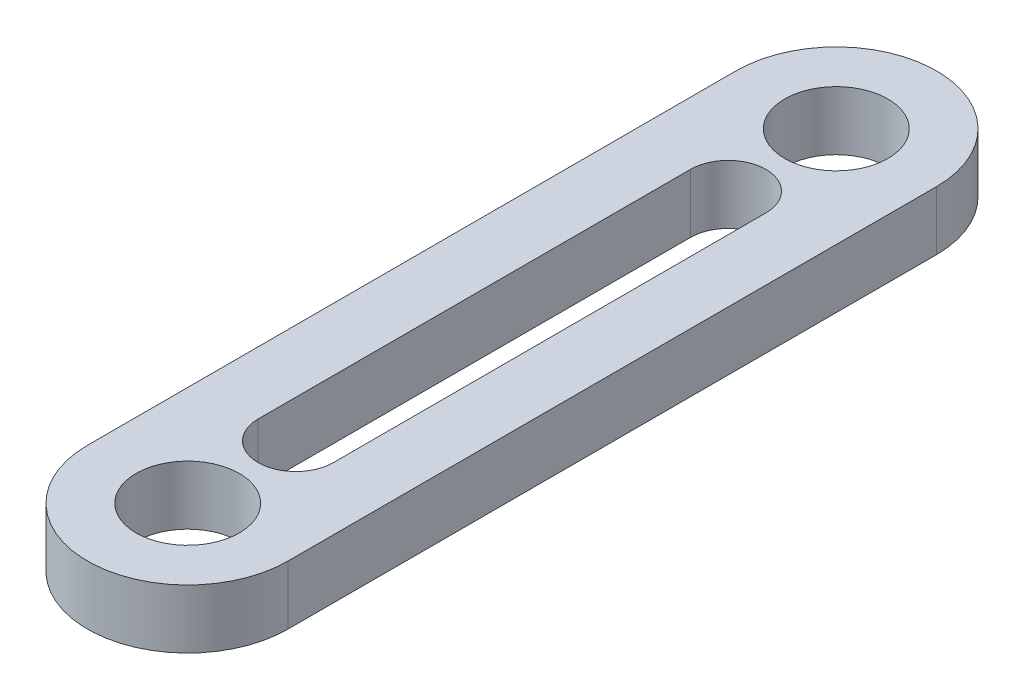
from build123d import *

# Parameters (mm, degrees)
BOSS_EXTRUDE1_DEPTH             = 10
M16_CLEARANCE_HOLE1_D           = 17.5
M16_CLEARANCE_HOLE1_ON_FACE_2_D = 17.5


with BuildPart() as part:
    # Sketch1 → Boss-Extrude1 (new body)
    with BuildSketch(Plane(origin=(0, 0, 0), x_dir=(1, 0, 0), z_dir=(0, 1, 0))):
        with BuildLine():
            Line((17, 0), (17, -110))
            ThreePointArc((17, -110), (0, -127), (-17, -110))
            Line((-17, -110), (-17, 0))
            ThreePointArc((-17, 0), (0, 17), (17, 0))
        make_face()
        with BuildLine():
            Line((-6.39610115, -91.666666667), (-6.39610115, -18.333333333))
            ThreePointArc((-6.39610115, -18.333333333), (0, -11.937232183), (6.39610115, -18.333333333))
            Line((6.39610115, -18.333333333), (6.39610115, -91.666666667))
            ThreePointArc((6.39610115, -91.666666667), (0, -98.062767817), (-6.39610115, -91.666666667))
        make_face(mode=Mode.SUBTRACT)
    extrude(amount=BOSS_EXTRUDE1_DEPTH)

    # M16 Clearance Hole1 (through all)
    with Locations(Plane(origin=(0, 10, 110), x_dir=(0, 0, 1), z_dir=(0, 1, 0))):
        with Locations((0, 0), (-110, 0)):
            Hole(M16_CLEARANCE_HOLE1_D / 2)

    # M16 Clearance Hole1 on face 2 (through all)
    with Locations(Plane(origin=(0, 0, 0), x_dir=(0, 0, -1), z_dir=(0, -1, 0))):
        with Locations((0, 0)):
            Hole(M16_CLEARANCE_HOLE1_ON_FACE_2_D / 2)


solid = part.part
